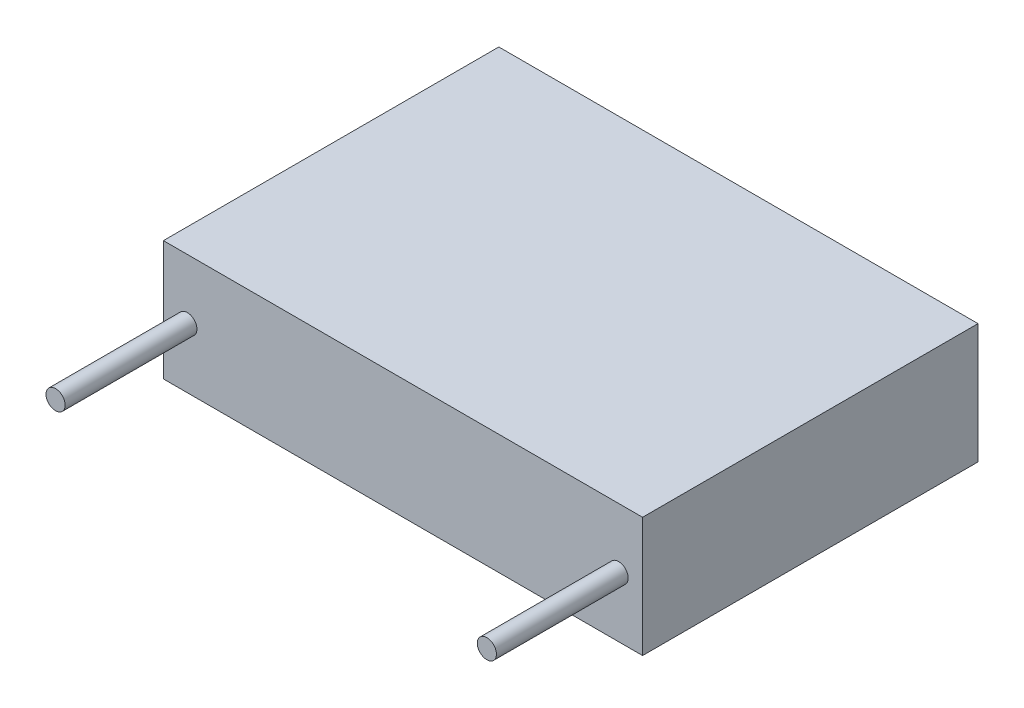
from build123d import *

# Parameters (mm, degrees)
SKETCH_1_W      = 20
SKETCH_1_H      = 5
EXTRUDE_1_DEPTH = 14
SKETCH_2_R      = 0.4
EXTRUDE_2_DEPTH = 5.5


with BuildPart() as part:
    # Эскиз1 → Вытянуть1 (new body)
    with BuildSketch(Plane.XY):
        with Locations((10, 2.5)):
            Rectangle(SKETCH_1_W, SKETCH_1_H)
    extrude(amount=EXTRUDE_1_DEPTH)

    # Эскиз2 → Вытянуть2 (add)
    with BuildSketch(Plane.XY.offset(14)):
        with Locations(Location((1, 2.5, 0), (0, 0, 180))):
            Circle(SKETCH_2_R)
        with Locations(Location((19, 2.5, 0), (0, 0, 180))):
            Circle(SKETCH_2_R)
    extrude(amount=EXTRUDE_2_DEPTH)


solid = part.part
